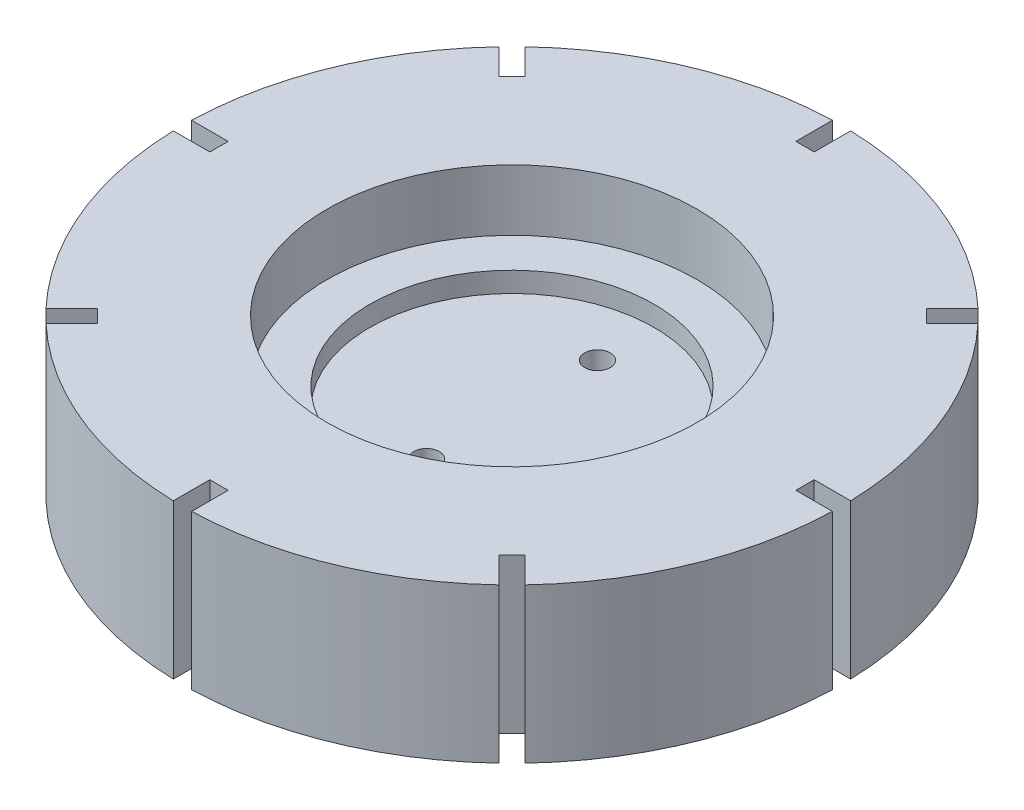
from build123d import *

# Parameters (mm, degrees)
SKETCH1_R           = 27
SKETCH1_R_2         = 1.05
BOSS_EXTRUDE1_DEPTH = 3
SKETCH2_R           = 27
SKETCH2_R_2         = 11.65
BOSS_EXTRUDE2_DEPTH = 1.65
SKETCH3_R           = 27
SKETCH3_R_2         = 15.15
BOSS_EXTRUDE3_DEPTH = 5
BOSS_EXTRUDE4_START = 3
SKETCH4_R           = 27
SKETCH4_R_2         = 1.875
BOSS_EXTRUDE4_DEPTH = 3
SKETCH5_W           = 1.5
SKETCH5_H           = 3.970266945
CUT_EXTRUDE1_DEPTH  = 41.224650402
CIRPATTERN1_COUNT   = 8


with BuildPart() as part:
    # Sketch1 → Boss-Extrude1 (new body)
    with BuildSketch(Plane(origin=(0, 0, 0), x_dir=(1, 0, 0), z_dir=(0, 1, 0))):
        with Locations(Location((0, 0, 0), (0, 0, 270))):
            Circle(SKETCH1_R)
        with Locations(Location((0, 7, 0), (0, 0, 270))):
            Circle(SKETCH1_R_2, mode=Mode.SUBTRACT)
        with Locations(Location((0, -7, 0), (0, 0, 270))):
            Circle(SKETCH1_R_2, mode=Mode.SUBTRACT)
    extrude(amount=BOSS_EXTRUDE1_DEPTH)

    # Sketch2 → Boss-Extrude2 (add)
    with BuildSketch(Plane(origin=(0, 3, 0), x_dir=(1, 0, 0), z_dir=(0, 1, 0))):
        with Locations(Location((0, 0, 0), (0, 0, 270))):
            Circle(SKETCH2_R)
        with Locations(Location((0, 0, 0), (0, 0, 270))):
            Circle(SKETCH2_R_2, mode=Mode.SUBTRACT)
    extrude(amount=BOSS_EXTRUDE2_DEPTH)

    # Sketch3 → Boss-Extrude3 (add)
    with BuildSketch(Plane(origin=(0, 4.65, 0), x_dir=(1, 0, 0), z_dir=(0, 1, 0))):
        with Locations(Location((0, 0, 0), (0, 0, 270))):
            Circle(SKETCH3_R)
        with Locations(Location((0, 0, 0), (0, 0, 270))):
            Circle(SKETCH3_R_2, mode=Mode.SUBTRACT)
    extrude(amount=BOSS_EXTRUDE3_DEPTH)

    # Sketch4 → Boss-Extrude4 (add)
    with BuildSketch(Plane.XZ.offset(BOSS_EXTRUDE4_START)):
        with Locations(Location((0, 0, 0), (0, 0, 270))):
            Circle(SKETCH4_R)
        with Locations(Location((0, -7, 0), (0, 0, 270))):
            Circle(SKETCH4_R_2, mode=Mode.SUBTRACT)
        with Locations(Location((0, 7, 0), (0, 0, 270))):
            Circle(SKETCH4_R_2, mode=Mode.SUBTRACT)
    extrude(amount=-BOSS_EXTRUDE4_DEPTH)

    # Sketch5 → Cut-Extrude1 (cut, through all)
    with BuildSketch(Plane(origin=(0, 9.65, 0), x_dir=(1, 0, 0), z_dir=(0, 1, 0))):
        with Locations((0, 25.985133473)):
            Rectangle(SKETCH5_W, SKETCH5_H)
    cut_extrude1 = extrude(amount=-CUT_EXTRUDE1_DEPTH, mode=Mode.SUBTRACT)

    # CirPattern1: Cut-Extrude1 ×8 about axis
    cirpattern1_axis = Axis((0, 0, 0), (0, 1, 0))
    for i in range(1, CIRPATTERN1_COUNT):
        add(cut_extrude1.rotate(cirpattern1_axis, i * 360 / CIRPATTERN1_COUNT), mode=Mode.SUBTRACT)


solid = part.part
